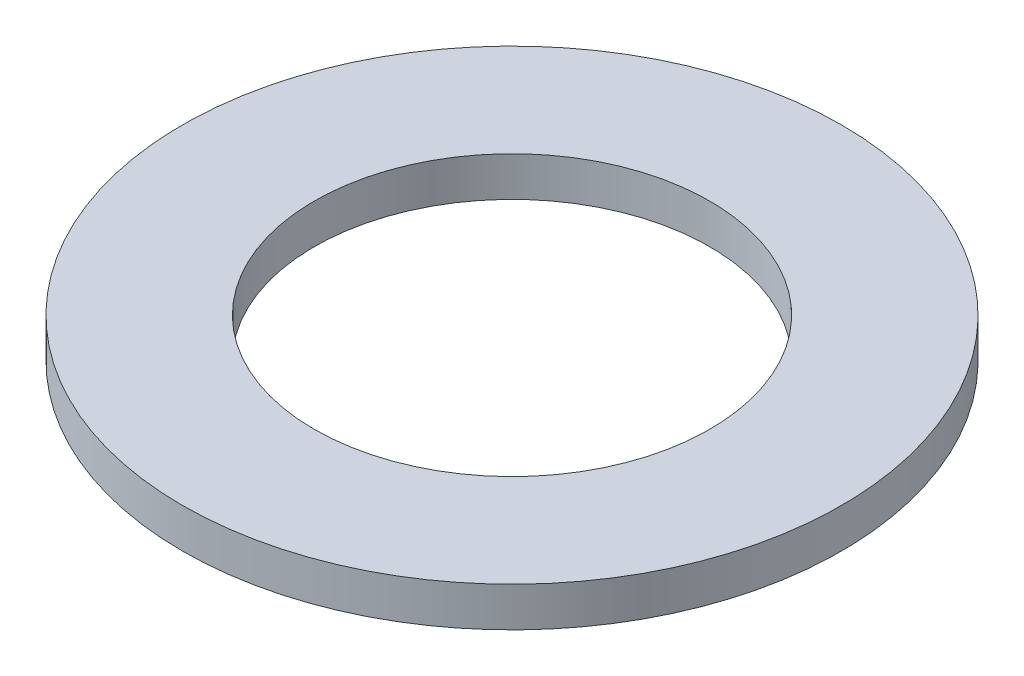
from build123d import *

# Parameters (mm, degrees)
SKETCH1_R           = 2.5
SKETCH1_R_2         = 1.5
BOSS_EXTRUDE1_DEPTH = 0.3


with BuildPart() as part:
    # Sketch1 → Boss-Extrude1 (new body)
    with BuildSketch(Plane(origin=(0, 0, 0), x_dir=(1, 0, 0), z_dir=(0, 1, 0))):
        with Locations(Location((0, 0, 0), (0, 0, 270))):
            Circle(SKETCH1_R)
        with Locations(Location((0, 0, 0), (0, 0, 270))):
            Circle(SKETCH1_R_2, mode=Mode.SUBTRACT)
    extrude(amount=BOSS_EXTRUDE1_DEPTH)


solid = part.part
